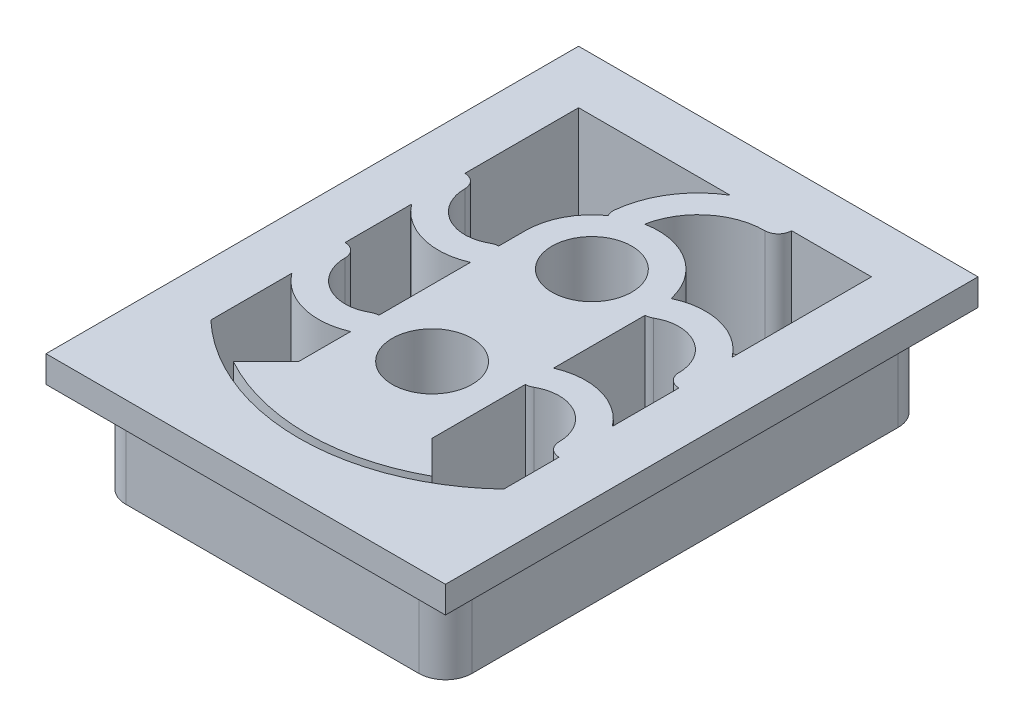
from build123d import *

# Parameters (mm, degrees)
SKETCH1_W           = 13
SKETCH1_H           = 18
BOSS_EXTRUDE1_DEPTH = 3.4
SKETCH2_W           = 15
SKETCH2_H           = 20
BOSS_EXTRUDE2_DEPTH = 1
SKETCH4_R           = 1.5
CUT_EXTRUDE2_DEPTH  = 14.251792332
FILLET1_R           = 1


with BuildPart() as part:
    # Sketch1 → Boss-Extrude1 (new body)
    with BuildSketch(Plane(origin=(0, 0, 0), x_dir=(1, 0, 0), z_dir=(0, 1, 0))):
        Rectangle(SKETCH1_W, SKETCH1_H)
    extrude(amount=BOSS_EXTRUDE1_DEPTH)

    # Sketch2 → Boss-Extrude2 (add)
    with BuildSketch(Plane(origin=(0, 3.4, 0), x_dir=(1, 0, 0), z_dir=(0, 1, 0))):
        Rectangle(SKETCH2_W, SKETCH2_H)
    extrude(amount=BOSS_EXTRUDE2_DEPTH)

    # Sketch4 → Cut-Extrude2 (cut, through all)
    with BuildSketch(Plane.XZ):
        with BuildLine():
            Line((-2.5, 5.5), (-3.734023309, 6.734023309))
            ThreePointArc((-3.734023309, 6.734023309), (0, 7.7), (3.734023309, 6.734023309))
            Line((3.734023309, 6.734023309), (2.5, 5.5))
            Line((2.5, 5.5), (2.5, 2))
            ThreePointArc((2.5, 2), (2.629409523, 1.982962913), (2.75, 1.933012702))
            ThreePointArc((2.75, 1.933012702), (4.25, 1.933012702), (5, 3.232050808))
            ThreePointArc((5, 3.232050808), (5.146446609, 3.585604198), (5.5, 3.732050808))
            Line((5.5, 3.732050808), (5.5, 5.809475019))
            ThreePointArc((5.5, 5.809475019), (0, 8), (-5.5, 5.809475019))
            Line((-5.5, 5.809475019), (-5.5, 2.767949192))
            ThreePointArc((-5.5, 2.767949192), (-4.137600278, 3.685275378), (-2.5, 3.55923704))
            Line((-2.5, 3.55923704), (-2.5, 5.5))
        make_face()
        with Locations(Location((0, 3, 0), (0, 0, 270))):
            Circle(SKETCH4_R)
        with BuildLine():
            Line((-2.5, -0.94076296), (-2.5, 2.5))
            ThreePointArc((-2.5, 2.5), (-2.629409523, 2.517037087), (-2.75, 2.566987298))
            ThreePointArc((-2.75, 2.566987298), (-4.25, 2.566987298), (-5, 1.267949192))
            ThreePointArc((-5, 1.267949192), (-5.146446609, 0.914395802), (-5.5, 0.767949192))
            Line((-5.5, 0.767949192), (-5.5, -1.732050808))
            ThreePointArc((-5.5, -1.732050808), (-4.137600278, -0.814724622), (-2.5, -0.94076296))
        make_face()
        with BuildLine():
            ThreePointArc((5.5, 1.732050808), (4.137600278, 0.814724622), (2.5, 0.94076296))
            Line((2.5, 0.94076296), (2.5, -2.5))
            ThreePointArc((2.5, -2.5), (2.629409523, -2.517037087), (2.75, -2.566987298))
            ThreePointArc((2.75, -2.566987298), (4.25, -2.566987298), (5, -1.267949192))
            ThreePointArc((5, -1.267949192), (5.146446609, -0.914395802), (5.5, -0.767949192))
            Line((5.5, -0.767949192), (5.5, 1.732050808))
        make_face()
        with Locations(Location((0, -3, 0), (0, 0, 270))):
            Circle(SKETCH4_R)
        with BuildLine():
            Line((-2.5, -3), (-2.5, -2))
            ThreePointArc((-2.5, -2), (-2.629409523, -1.982962913), (-2.75, -1.933012702))
            ThreePointArc((-2.75, -1.933012702), (-4.25, -1.933012702), (-5, -3.232050808))
            ThreePointArc((-5, -3.232050808), (-5.146446609, -3.585604198), (-5.5, -3.732050808))
            Line((-5.5, -3.732050808), (-5.5, -8))
            Line((-5.5, -8), (0.192885679, -8))
            ThreePointArc((0.192885679, -8), (-0.966559904, -6.870975799), (-1.497403196, -5.342180487))
            ThreePointArc((-1.497403196, -5.342180487), (-1.489544615, -5.189572213), (-1.435960525, -5.046464603))
            ThreePointArc((-1.435960525, -5.046464603), (-2.218096178, -4.153277653), (-2.5, -3))
        make_face()
        with BuildLine():
            ThreePointArc((5.5, -2.767949192), (4.107029075, -3.693132835), (2.442465304, -3.533257199))
            ThreePointArc((2.442465304, -3.533257199), (1.376562779, -5.086881625), (-0.471204729, -5.455191663))
            ThreePointArc((-0.471204729, -5.455191663), (0.396247062, -6.922515496), (2, -7.5))
            ThreePointArc((2, -7.5), (2.353553391, -7.646446609), (2.5, -8))
            Line((2.5, -8), (5.5, -8))
            Line((5.5, -8), (5.5, -2.767949192))
        make_face()
    extrude(amount=-CUT_EXTRUDE2_DEPTH, mode=Mode.SUBTRACT)

    # Fillet1
    fillet1_edges = [part.edges().sort_by_distance(p)[0] for p in [
        (6.5, 1.7, 9),
        (-6.5, 1.7, 9),
        (-6.5, 1.7, -9),
        (6.5, 1.7, -9),
    ]]
    fillet(fillet1_edges, radius=FILLET1_R)


solid = part.part
